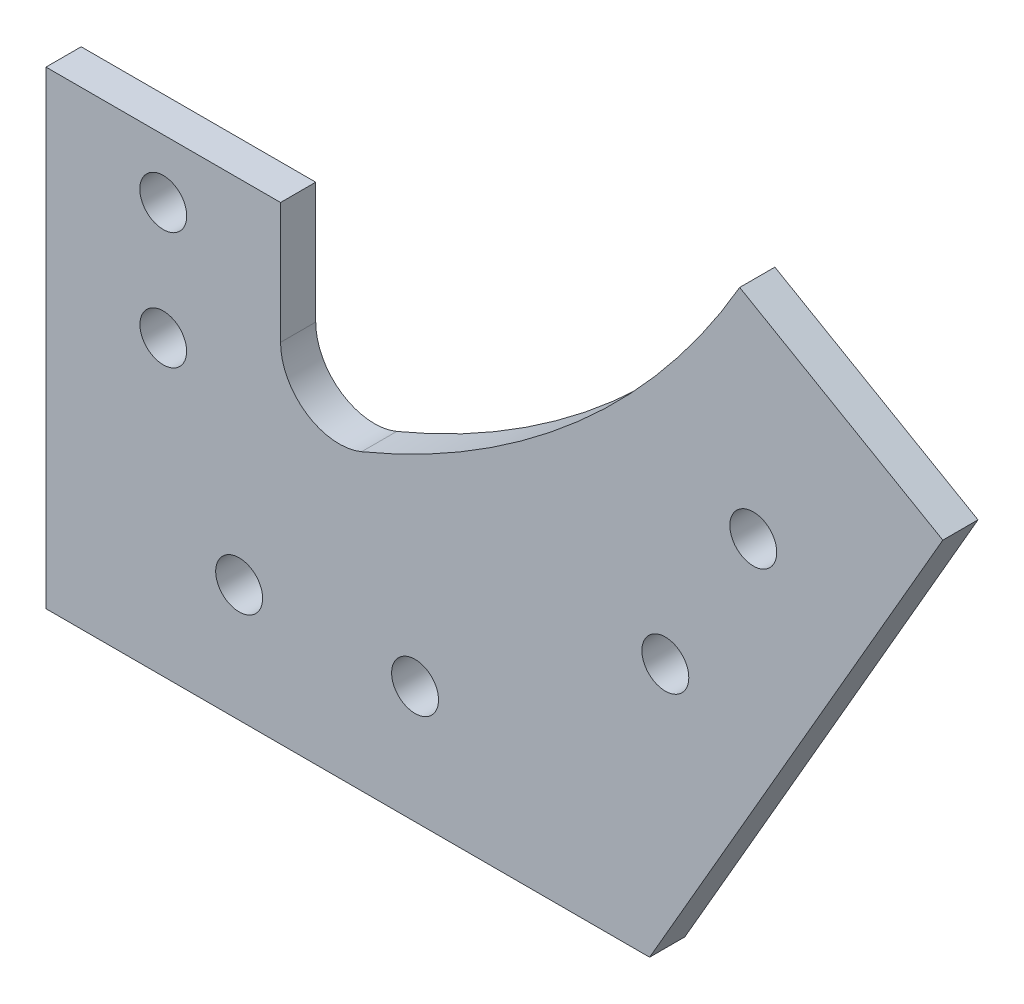
from build123d import *

# Parameters (mm, degrees)
SKETCH_1_R      = 2
SKETCH_1_R_2    = 1.99
EXTRUDE_1_DEPTH = 3


with BuildPart() as part:
    # 草图1 → 凸台-拉伸1 (new body)
    with BuildSketch(Plane.XY):
        with BuildLine():
            Line((-16.651457747, -45.984160086), (-16.651457747, -35.65505653))
            Line((-16.651457747, -35.65505653), (-36.651457747, -35.65505653))
            Line((-36.651457747, -35.65505653), (-36.651457747, -75.65505653))
            Line((-36.651457747, -75.65505653), (14.818542253, -75.65505653))
            Line((14.818542253, -75.65505653), (39.818542253, -32.353786341))
            Line((39.818542253, -32.353786341), (22.498034177, -22.353786341))
            ThreePointArc((22.498034177, -22.353786341), (8.713172451, -39.144030649), (-9.741633911, -50.605044516))
            ThreePointArc((-9.741633911, -50.605044516), (-14.430925396, -50.140427593), (-16.651457747, -45.984160086))
        make_face()
        with Locations((-26.651457747, -40.65505653)):
            Circle(SKETCH_1_R, mode=Mode.SUBTRACT)
        with Locations((-26.651457747, -50.65505653)):
            Circle(SKETCH_1_R_2, mode=Mode.SUBTRACT)
        with Locations((-20.181457747, -65.65505653)):
            Circle(SKETCH_1_R, mode=Mode.SUBTRACT)
        with Locations((-5.181457747, -65.65505653)):
            Circle(SKETCH_1_R, mode=Mode.SUBTRACT)
        with Locations((16.158288215, -53.334548455)):
            Circle(SKETCH_1_R, mode=Mode.SUBTRACT)
        with Locations((23.658288215, -40.344167398)):
            Circle(SKETCH_1_R, mode=Mode.SUBTRACT)
    extrude(amount=EXTRUDE_1_DEPTH)


solid = part.part
